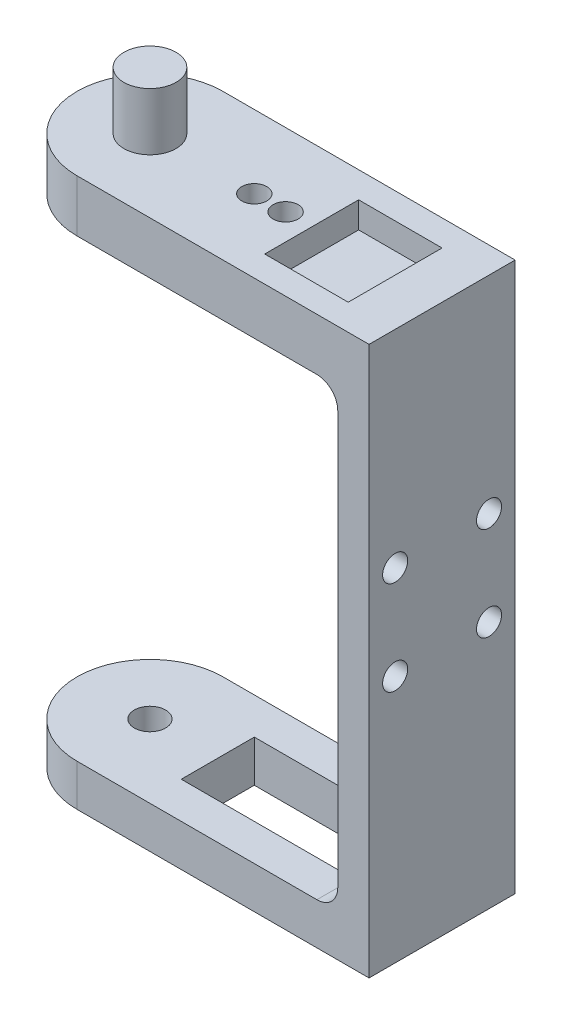
from build123d import *

# Parameters (mm, degrees)
BOSS_EXTRUDE1_DEPTH      = 5
BOSS_EXTRUDE2_DEPTH      = 4
SKETCH3_W                = 3
SKETCH3_H                = 52.6
BOSS_EXTRUDE3_DEPTH      = 7
SKETCH4_R                = 2.5
BOSS_EXTRUDE4_DEPTH      = 5.5
SKETCH5_R                = 3.7
CUT_EXTRUDE2_DEPTH       = 1.6
CUT_EXTRUDE4_DEPTH       = 1.6
SKETCH7_R                = 2.5
CUT_EXTRUDE6_DEPTH       = 1.6
SKETCH8_R                = 1.5
CUT_EXTRUDE8_DEPTH       = 4
M2_CLEARANCE_HOLE1_D     = 2.4
M2_CLEARANCE_HOLE1_DEPTH = 5
M2_CLEARANCE_HOLE1_TIP   = 0.721032743
M2_CLEARANCE_HOLE2_D     = 2.4
M2_CLEARANCE_HOLE2_DEPTH = 5
M2_CLEARANCE_HOLE2_TIP   = 0.721032743
M2_CLEARANCE_HOLE3_D     = 2.4
M2_CLEARANCE_HOLE3_DEPTH = 35
M2_CLEARANCE_HOLE4_D     = 2.4
M2_CLEARANCE_HOLE4_DEPTH = 35
M2_CLEARANCE_HOLE5_D     = 2.4
M2_CLEARANCE_HOLE5_DEPTH = 35
M2_CLEARANCE_HOLE6_D     = 2.4
M2_CLEARANCE_HOLE6_DEPTH = 35
FILLET1_R                = 2
SKETCH21_W               = 15
SKETCH21_H               = 7
CUT_EXTRUDE10_DEPTH      = 4
SKETCH22_W               = 8
SKETCH22_H               = 9
CUT_EXTRUDE11_DEPTH      = 2.5


with BuildPart() as part:
    # Sketch1 → Boss-Extrude1 (new body)
    with BuildSketch(Plane(origin=(0, 19.3, 0), x_dir=(1, 0, 0), z_dir=(0, 1, 0))):
        with BuildLine():
            Line((5.5, -7), (33.5, -7))
            Line((33.5, -7), (33.5, 7))
            Line((33.5, 7), (5.5, 7))
            ThreePointArc((5.5, 7), (-1.5, 0), (5.5, -7))
        make_face()
    extrude(amount=BOSS_EXTRUDE1_DEPTH)



with BuildPart() as body_2:
    # Sketch2 → Boss-Extrude2 (new body)
    with BuildSketch(Plane(origin=(0, -28.3, 0), x_dir=(1, 0, 0), z_dir=(0, 1, 0))):
        with BuildLine():
            Line((5.5, -7), (33.5, -7))
            Line((33.5, -7), (33.5, 7))
            Line((33.5, 7), (5.5, 7))
            ThreePointArc((5.5, 7), (-1.5, 0), (5.5, -7))
        make_face()
    extrude(amount=BOSS_EXTRUDE2_DEPTH)


with BuildPart() as part_1:
    add(part.part)

    add(body_2.part)  # Boss-Extrude3 merges body 2
    # Sketch3 → Boss-Extrude3 (add, symmetric)
    with BuildSketch(Plane.XY):
        with Locations((32, -2)):
            Rectangle(SKETCH3_W, SKETCH3_H)
    extrude(amount=BOSS_EXTRUDE3_DEPTH, both=True)

    # Sketch4 → Boss-Extrude4 (add)
    with BuildSketch(Plane(origin=(0, 24.3, 0), x_dir=(1, 0, 0), z_dir=(0, 1, 0))):
        with Locations(Location((5.5, 0, 0), (0, 0, 270))):
            Circle(SKETCH4_R)
    extrude(amount=BOSS_EXTRUDE4_DEPTH)

    # Sketch5 → Cut-Extrude2 (cut)
    with BuildSketch(Plane(origin=(0, 19.3, 0), x_dir=(1, 0, 0), z_dir=(0, 1, 0))):
        with Locations(Location((5.5, 0, 0), (0, 0, 270))):
            Circle(SKETCH5_R)
    extrude(amount=CUT_EXTRUDE2_DEPTH, mode=Mode.SUBTRACT)

    # Sketch6 → Cut-Extrude4 (cut)
    with BuildSketch(Plane(origin=(0, 19.3, 0), x_dir=(1, 0, 0), z_dir=(0, 1, 0))):
        with BuildLine():
            Line((5.5, -2.7), (20.7, -2.7))
            Line((20.7, -2.7), (20.7, 2.7))
            Line((20.7, 2.7), (5.5, 2.7))
            ThreePointArc((5.5, 2.7), (2.8, 0), (5.5, -2.7))
        make_face()
    extrude(amount=CUT_EXTRUDE4_DEPTH, mode=Mode.SUBTRACT)

    # Sketch7 → Cut-Extrude6 (cut)
    with BuildSketch(Plane(origin=(0, 20.9, 0), x_dir=(1, 0, 0), z_dir=(0, 1, 0))):
        with Locations(Location((5.5, 0, 0), (0, 0, 270))):
            Circle(SKETCH7_R)
    extrude(amount=CUT_EXTRUDE6_DEPTH, mode=Mode.SUBTRACT)

    # Sketch8 → Cut-Extrude8 (cut)
    with BuildSketch(Plane(origin=(0, -28.3, 0), x_dir=(1, 0, 0), z_dir=(0, 1, 0))):
        with Locations(Location((5.5, 0, 0), (0, 0, 270))):
            Circle(SKETCH8_R)
    extrude(amount=CUT_EXTRUDE8_DEPTH, mode=Mode.SUBTRACT)

    # M2 Clearance Hole1
    with Locations(Plane(origin=(0, 24.3, 0), x_dir=(1, 0, 0), z_dir=(0, 1, 0))):
        with Locations((15.5, 0)):
            Hole(M2_CLEARANCE_HOLE1_D / 2, depth=M2_CLEARANCE_HOLE1_DEPTH)
            with Locations((0, 0, -(M2_CLEARANCE_HOLE1_DEPTH + M2_CLEARANCE_HOLE1_TIP / 2))):  # 118° drill point
                Cone(0, M2_CLEARANCE_HOLE1_D / 2, M2_CLEARANCE_HOLE1_TIP, mode=Mode.SUBTRACT)

    # M2 Clearance Hole2
    with Locations(Plane(origin=(0, 24.3, 0), x_dir=(1, 0, 0), z_dir=(0, 1, 0))):
        with Locations((18.5, 0)):
            Hole(M2_CLEARANCE_HOLE2_D / 2, depth=M2_CLEARANCE_HOLE2_DEPTH)
            with Locations((0, 0, -(M2_CLEARANCE_HOLE2_DEPTH + M2_CLEARANCE_HOLE2_TIP / 2))):  # 118° drill point
                Cone(0, M2_CLEARANCE_HOLE2_D / 2, M2_CLEARANCE_HOLE2_TIP, mode=Mode.SUBTRACT)

    # M2 Clearance Hole3
    with Locations(Plane(origin=(33.5, 0, 0), x_dir=(0, 0, -1), z_dir=(1, 0, 0))):
        with Locations((4.5, -4.5)):
            Hole(M2_CLEARANCE_HOLE3_D / 2, depth=M2_CLEARANCE_HOLE3_DEPTH)

    # M2 Clearance Hole4
    with Locations(Plane(origin=(33.5, 0, 0), x_dir=(0, 0, -1), z_dir=(1, 0, 0))):
        with Locations((-4.5, -4.5)):
            Hole(M2_CLEARANCE_HOLE4_D / 2, depth=M2_CLEARANCE_HOLE4_DEPTH)

    # M2 Clearance Hole5
    with Locations(Plane(origin=(33.5, 0, 0), x_dir=(0, 0, -1), z_dir=(1, 0, 0))):
        with Locations((4.5, 4.5)):
            Hole(M2_CLEARANCE_HOLE5_D / 2, depth=M2_CLEARANCE_HOLE5_DEPTH)

    # M2 Clearance Hole6
    with Locations(Plane(origin=(33.5, 0, 0), x_dir=(0, 0, -1), z_dir=(1, 0, 0))):
        with Locations((-4.5, 4.5)):
            Hole(M2_CLEARANCE_HOLE6_D / 2, depth=M2_CLEARANCE_HOLE6_DEPTH)

    # Fillet1
    fillet1_edges = [part_1.edges().sort_by_distance(p)[0] for p in [
        (30.5, 19.3, 0),
        (30.5, -24.3, 0),
    ]]
    fillet(fillet1_edges, radius=FILLET1_R)

    # Sketch21 → Cut-Extrude10 (cut)
    with BuildSketch(Plane(origin=(0, -28.3, 0), x_dir=(1, 0, 0), z_dir=(0, 1, 0))):
        with Locations((19.5, 0)):
            Rectangle(SKETCH21_W, SKETCH21_H)
    extrude(amount=CUT_EXTRUDE10_DEPTH, mode=Mode.SUBTRACT)

    # Sketch22 → Cut-Extrude11 (cut)
    with BuildSketch(Plane(origin=(0, 24.3, 0), x_dir=(1, 0, 0), z_dir=(0, 1, 0))):
        with Locations((25, 0)):
            Rectangle(SKETCH22_W, SKETCH22_H)
    extrude(amount=-CUT_EXTRUDE11_DEPTH, mode=Mode.SUBTRACT)


solid = part_1.part
